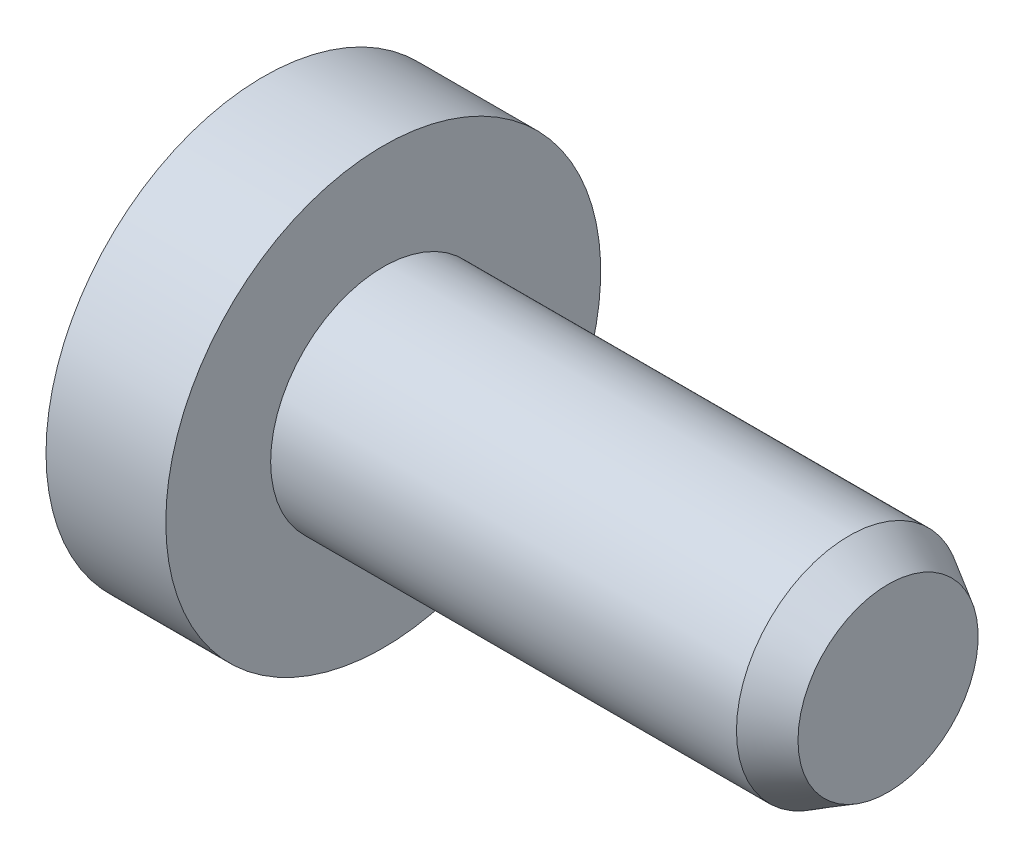
from build123d import *

# Parameters (mm, degrees)
CHAMFER1_SIZE      = 0.29
CHAMFER1_SIZE2     = 0.502294734
CUT_EXTRUDE1_DEPTH = 1.4
CUT_EXTRUDE1_TAPER = 6


with BuildPart() as part:
    # Sketch1 → Revolve1 (revolve)
    with BuildSketch(Plane.XY, mode=Mode.PRIVATE) as revolve1_sk:
        with BuildLine():
            Line((0, 2.8), (-1.542463035, 2.8))
            ThreePointArc((-1.542463035, 2.8), (-2.180811394, 1.464186604), (-2.4, 0))
            Line((-2.4, 0), (6.5, 0))
            Line((6.5, 0), (6.5, 1.45))
            Line((6.5, 1.45), (0, 1.45))
            Line((0, 1.45), (0, 2.8))
        make_face()
    revolve(revolve1_sk.sketch.rotate(Axis((0, 0, 0), (1, 0, 0)), 90), axis=Axis((0, 0, 0), (1, 0, 0)))

    # Chamfer1
    chamfer1_edges = [part.edges().sort_by_distance(p)[0] for p in [
        (6.5, 0, -1.45),
    ]]
    chamfer1_side = [part.faces().sort_by_distance(p)[0] for p in [
        (6.5, 0, 0),
    ]]
    chamfer(chamfer1_edges, length=CHAMFER1_SIZE, length2=CHAMFER1_SIZE2, reference=chamfer1_side[0])

    # Sketch3 → Cut-Extrude1 (cut)
    with BuildSketch(Plane(origin=(-2.4, 0, 0), x_dir=(0, 0, -1), z_dir=(1, 0, 0))):
        Polygon((-0.375, 1.5), (-0.225, 0.9), (-0.472067148, 0.472067148), (-0.9, 0.225), (-1.5, 0.375), (-1.5, -0.375), (-0.9, -0.225), (-0.472067148, -0.472067148), (-0.225, -0.9), (-0.375, -1.5), (0.375, -1.5), (0.225, -0.9), (0.472067148, -0.472067148), (0.9, -0.225), (1.5, -0.375), (1.5, 0.375), (0.9, 0.225), (0.472067148, 0.472067148), (0.225, 0.9), (0.375, 1.5), align=None)
    extrude(amount=CUT_EXTRUDE1_DEPTH, taper=CUT_EXTRUDE1_TAPER, mode=Mode.SUBTRACT)


solid = part.part
